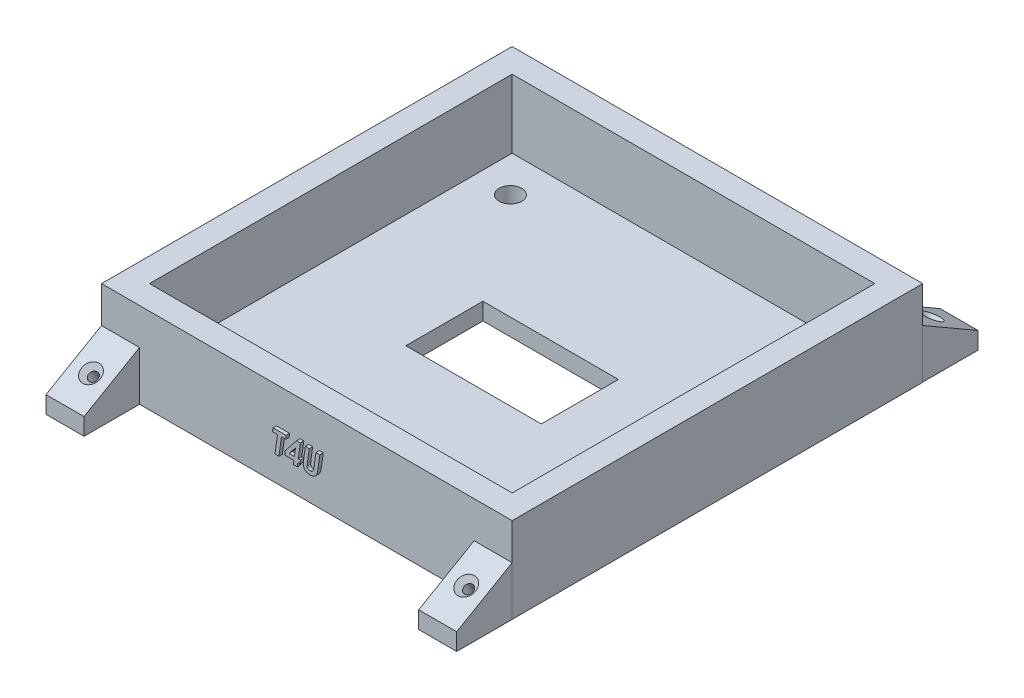
from build123d import *

# Parameters (mm, degrees)
SKETCH1_W                                            = 106
SKETCH1_H                                            = 106
SKETCH1_W_2                                          = 39.59401571
SKETCH1_H_2                                          = 22.527629628
BOSS_EXTRUDE1_DEPTH                                  = 5
SKETCH1_4_W                                          = 106
SKETCH1_4_H                                          = 106
BOSS_EXTRUDE2_DEPTH                                  = 25
SKETCH1_6_W                                          = 11.041643383
SKETCH1_6_H                                          = 16.216795515
BOSS_EXTRUDE4_DEPTH                                  = 5
SKETCH1_8_W                                          = 11.041643383
SKETCH1_8_H                                          = 16.216795515
BOSS_EXTRUDE5_DEPTH                                  = 5
SKETCH1_10_W                                         = 11.121003358
SKETCH1_10_H                                         = 16.216795515
SKETCH1_10_W_2                                       = 11.11598595
BOSS_EXTRUDE7_DEPTH                                  = 5
DRAFT1_ANGLE                                         = 1
DRAFT2_ANGLE                                         = 45
DRAFT3_ANGLE                                         = 30
DRAFT4_ANGLE                                         = 30
DRAFT6_ANGLE                                         = 30
DRAFT7_ANGLE                                         = 30
CSK_FOR_M2_5_OVAL_HEAD_MACHINE_SCREW1_D              = 2.7
CSK_FOR_M2_5_OVAL_HEAD_MACHINE_SCREW1_CSINK_D        = 5.5
CSK_FOR_M2_5_OVAL_HEAD_MACHINE_SCREW1_CSINK_ANGLE    = 90
CSK_FOR_M2_5_OVAL_HEAD_MACHINE_SCREW1_ON_D           = 2.7
CSK_FOR_M2_5_OVAL_HEAD_MACHINE_SCREW1_ON_CSINK_D     = 5.5
CSK_FOR_M2_5_OVAL_HEAD_MACHINE_SCREW1_ON_CSINK_ANGLE = 90
CSK_FOR_M2_5_OVAL_HEAD_MACHINE_SCREW_2_D             = 2.7
CSK_FOR_M2_5_OVAL_HEAD_MACHINE_SCREW_2_CSINK_D       = 5.5
CSK_FOR_M2_5_OVAL_HEAD_MACHINE_SCREW_2_CSINK_ANGLE   = 90
BOSS_EXTRUDE9_DEPTH                                  = 1
SKETCH14_R                                           = 3.296320564
CUT_EXTRUDE1_DEPTH                                   = 10


with BuildPart() as part:
    # Sketch1 → Boss-Extrude1 (new body)
    with BuildSketch(Plane(origin=(0, 0, 0), x_dir=(1, 0, 0), z_dir=(0, 1, 0))):
        with Locations((5.031290625, 4.83488638)):
            Rectangle(SKETCH1_W, SKETCH1_H)
        with Locations((5.031290625, 4.83488638)):
            Rectangle(SKETCH1_W_2, SKETCH1_H_2, mode=Mode.SUBTRACT)
    extrude(amount=BOSS_EXTRUDE1_DEPTH)

    # Sketch1<4> → Boss-Extrude2 (add)
    with BuildSketch(Plane(origin=(0, 0, 0), x_dir=(1, 0, 0), z_dir=(0, 1, 0))):
        Polygon((-54.910689044, 64.83488638), (-54.968709375, 64.83488638), (-54.968709375, -55.16511362), (-43.869045661, -55.16511362), (53.931626911, -55.16511362), (65.031290625, -55.16511362), (65.031290625, 64.83488638), (64.973270294, 64.83488638), (53.931626911, 64.83488638), (-43.869045661, 64.83488638), align=None)
        with Locations((5.031290625, 4.83488638)):
            Rectangle(SKETCH1_4_W, SKETCH1_4_H, mode=Mode.SUBTRACT)
    extrude(amount=BOSS_EXTRUDE2_DEPTH)

    # Sketch1<6> → Boss-Extrude4 (add)
    with BuildSketch(Plane(origin=(0, 0, 0), x_dir=(1, 0, 0), z_dir=(0, 1, 0))):
        with Locations((-49.389867353, 72.943284138)):
            Rectangle(SKETCH1_6_W, SKETCH1_6_H)
    extrude(amount=BOSS_EXTRUDE4_DEPTH)

    # Sketch1<8> → Boss-Extrude5 (add)
    with BuildSketch(Plane(origin=(0, 0, 0), x_dir=(1, 0, 0), z_dir=(0, 1, 0))):
        with Locations((59.452448602, 72.943284138)):
            Rectangle(SKETCH1_8_W, SKETCH1_8_H)
    extrude(amount=BOSS_EXTRUDE5_DEPTH)

    # Sketch1<10> → Boss-Extrude7 (add)
    with BuildSketch(Plane(origin=(0, 0, 0), x_dir=(1, 0, 0), z_dir=(0, 1, 0))):
        with Locations((-49.42954734, -63.273511378)):
            Rectangle(SKETCH1_10_W, SKETCH1_10_H)
        with Locations((59.489619886, -63.273511378)):
            Rectangle(SKETCH1_10_W_2, SKETCH1_10_H)
    extrude(amount=BOSS_EXTRUDE7_DEPTH)

    # Draft1
    draft1_faces = [part.faces().sort_by_distance(p)[0] for p in [
        (59.489619886, 5, 63.273511377),
    ]]
    draft(draft1_faces, Plane(origin=(0, 5, 71.381909135), x_dir=(1, 0, 0), z_dir=(0, 0, 1)), DRAFT1_ANGLE)

    # Draft2
    draft2_faces = [part.faces().sort_by_distance(p)[0] for p in [
        (59.489619886, 5.141532609, 63.273511377),
    ]]
    draft(draft2_faces, Plane(origin=(0, 5, 71.381909135), x_dir=(1, 0, 0), z_dir=(0, 0, 1)), DRAFT2_ANGLE)

    # Draft3
    draft3_faces = [part.faces().sort_by_distance(p)[0] for p in [
        (59.489619886, 13.108397758, 63.273511377),
    ]]
    draft(draft3_faces, Plane(origin=(0, 5, 71.381909135), x_dir=(1, 0, 0), z_dir=(0, 0, 1)), DRAFT3_ANGLE)

    # Draft4
    draft4_faces = [part.faces().sort_by_distance(p)[0] for p in [
        (-49.42954734, 5, 63.273511377),
    ]]
    draft(draft4_faces, Plane(origin=(0, 5, 71.381909135), x_dir=(1, 0, 0), z_dir=(0, 0, 1)), DRAFT4_ANGLE)

    # Draft6
    draft6_faces = [part.faces().sort_by_distance(p)[0] for p in [
        (-49.389867352, 5, -72.943284138),
    ]]
    draft(draft6_faces, Plane(origin=(0, 5, -81.051681895), x_dir=(-1, 0, 0), z_dir=(0, 0, -1)), DRAFT6_ANGLE)

    # Draft7
    draft7_faces = [part.faces().sort_by_distance(p)[0] for p in [
        (59.452448603, 5, -72.943284138),
    ]]
    draft(draft7_faces, Plane(origin=(0, 5, -81.051681895), x_dir=(-1, 0, 0), z_dir=(0, 0, -1)), DRAFT7_ANGLE)

    # CSK for M2.5 Oval Head Machine Screw1 (through all)
    with Locations(Plane(origin=(59.56504546, 9.768238454, 63.123077871), x_dir=(0, -0.5, 0.866025403784), z_dir=(0, 0.866025403784, 0.5))):
        with Locations((0, 0)):
            CounterSinkHole(CSK_FOR_M2_5_OVAL_HEAD_MACHINE_SCREW1_D / 2, CSK_FOR_M2_5_OVAL_HEAD_MACHINE_SCREW1_CSINK_D / 2, counter_sink_angle=CSK_FOR_M2_5_OVAL_HEAD_MACHINE_SCREW1_CSINK_ANGLE)

    # CSK for M2.5 Oval Head Machine Screw1 on (through all)
    with Locations(Plane(origin=(-49.429743133, 9.378105131, 63.798808608), x_dir=(0, -0.500000174844, 0.866025302838), z_dir=(0, 0.866025302838, 0.500000174844))):
        with Locations((0, 0)):
            CounterSinkHole(CSK_FOR_M2_5_OVAL_HEAD_MACHINE_SCREW1_ON_D / 2, CSK_FOR_M2_5_OVAL_HEAD_MACHINE_SCREW1_ON_CSINK_D / 2, counter_sink_angle=CSK_FOR_M2_5_OVAL_HEAD_MACHINE_SCREW1_ON_CSINK_ANGLE)

    # CSK for M2.5 Oval Head Machine Screw 2 (through all)
    with Locations(Plane(origin=(58.993450062, 9.334850022, -73.543501414), x_dir=(0, 0.500000174844, 0.866025302838), z_dir=(0, 0.866025302838, -0.500000174844))):
        with Locations((-1e-09, 0), (0.598054978, -108.445190593)):
            CounterSinkHole(CSK_FOR_M2_5_OVAL_HEAD_MACHINE_SCREW_2_D / 2, CSK_FOR_M2_5_OVAL_HEAD_MACHINE_SCREW_2_CSINK_D / 2, counter_sink_angle=CSK_FOR_M2_5_OVAL_HEAD_MACHINE_SCREW_2_CSINK_ANGLE)

    # Sketch12 → Boss-Extrude9 (add)
    # profile 1 of 3: a face of its own
    with BuildSketch(Plane.XY.offset(55.16511362)):
        Polygon((-3.851170658, 14.560171439), (-0.024888607, 14.560171439), (-0.162268415, 13.501838106), (-1.398686684, 13.501838106), (-2.132651027, 8.210171439), (-3.281298864, 8.210171439), (-2.548606556, 13.501838106), (-3.997454713, 13.501838106), align=None)
    # profile 2 of 3: a face of its own
    with BuildSketch(Plane.XY.offset(55.16511362)):
        Polygon((3.033084149, 14.722991952), (4.138482787, 14.722991952), (3.543170287, 10.408248363), (4.165195527, 10.408248363), (4.02781572, 9.349915029), (3.398158268, 9.349915029), (3.240425896, 8.210171439), (2.09177806, 8.210171439), (2.249510431, 9.349915029), (-0.431939889, 9.349915029), (-0.350529633, 10.451497561), align=None)
        Polygon((2.722707547, 12.786954292), (0.838823332, 10.408248363), (2.394522451, 10.408248363), align=None, mode=Mode.SUBTRACT)
    # profile 3 of 3: a face of its own
    with BuildSketch(Plane.XY.offset(55.16511362)):
        with BuildLine():
            Line((5.587330944, 14.560171439), (6.737250816, 14.560171439))
            Line((6.737250816, 14.560171439), (6.18900362, 10.632126568))
            add(Edge.make_bspline(
                [(6.18900362, 10.632126568), (6.183402023, 10.589736798), (6.172653558, 10.508398408), (6.158581474, 10.390948009), (6.147050147, 10.283246207), (6.13835648, 10.185232364), (6.130880723, 10.097032869), (6.123537243, 10.018693331), (6.12156611, 9.949475892), (6.120711369, 9.906641739), (6.120313717, 9.886713907)],
                knots=[0, 0, 0, 0, 1.370131483, 2.629037392, 3.790386942, 4.840899086, 5.781938864, 6.627066857, 7.36126714, 8, 8, 8, 8], degree=3))
            add(Edge.make_bspline(
                [(6.120313717, 9.886713907), (6.122742642, 9.828360814), (6.127388042, 9.71675862), (6.16976809, 9.558832982), (6.242605071, 9.422303405), (6.342570448, 9.306046085), (6.471150802, 9.214343156), (6.626800051, 9.151679105), (6.806028148, 9.111359223), (6.934173097, 9.107645252), (7.001834149, 9.10568426)],
                knots=[0, 0, 0, 0, 1.044998619, 1.998593913, 2.903381636, 3.798178852, 4.724466667, 5.705876195, 6.788693348, 8, 8, 8, 8], degree=3))
            add(Edge.make_bspline(
                [(7.001834149, 9.10568426), (7.057956567, 9.10757675), (7.167183867, 9.111259975), (7.325257031, 9.141736219), (7.473400904, 9.188647388), (7.56300684, 9.236972554), (7.607322931, 9.260872561)],
                knots=[0, 0, 0, 0, 1.064320597, 2.071415827, 3.046186936, 4, 4, 4, 4], degree=3))
            add(Edge.make_bspline(
                [(7.607322931, 9.260872561), (7.638661016, 9.282340052), (7.702720081, 9.326222359), (7.786339544, 9.413823207), (7.858235271, 9.520602949), (7.910381874, 9.624167973), (7.948256851, 9.722135286), (7.977464559, 9.813799465), (8.004312179, 9.922521662), (8.034401264, 10.046840649), (8.061248289, 10.18798869), (8.090077245, 10.345103027), (8.115677693, 10.519286472), (8.133525812, 10.641031997), (8.142849774, 10.704632577)],
                knots=[0, 0, 0, 0, 0.859785812, 1.75751252, 2.725816041, 3.770921983, 4.379908327, 5.106796295, 5.951169398, 6.919234109, 8.007475297, 9.209126838, 10.542031388, 12, 12, 12, 12], degree=3))
            Line((8.142849774, 10.704632577), (8.680920688, 14.560171439))
            Line((8.680920688, 14.560171439), (9.83084056, 14.560171439))
            Line((9.83084056, 14.560171439), (9.300401858, 10.761874164))
            add(Edge.make_bspline(
                [(9.300401858, 10.761874164), (9.287330457, 10.668092192), (9.262027799, 10.486555944), (9.217376218, 10.225362872), (9.170597614, 9.984815521), (9.121368674, 9.764847607), (9.067892151, 9.565539541), (9.013042193, 9.38586844), (8.953041543, 9.227611129), (8.890292597, 9.087508153), (8.821373712, 8.962161975), (8.747602604, 8.845752783), (8.666530187, 8.737141123), (8.575826106, 8.63806749), (8.481605009, 8.543048189), (8.377649998, 8.458270008), (8.267945247, 8.379873555), (8.150621707, 8.310376789), (8.026985628, 8.247221014), (7.895497152, 8.194520818), (7.758455425, 8.148438624), (7.614268415, 8.111548668), (7.463936721, 8.082329695), (7.306681889, 8.062566996), (7.143267757, 8.04903768), (7.031968043, 8.047921181), (6.975121409, 8.047350927)],
                knots=[0, 0, 0, 0, 1.689301192, 3.270025079, 4.726951413, 6.061161684, 7.290631986, 8.408026906, 9.411210366, 10.308389253, 11.14458747, 11.960942218, 12.765860093, 13.558707188, 14.355765744, 15.150991277, 15.948624031, 16.759492273, 17.581610214, 18.423095804, 19.284310986, 20.159533266, 21.076429259, 22.014764283, 22.986035413, 24, 24, 24, 24], degree=3))
            add(Edge.make_bspline(
                [(6.975121409, 8.047350927), (6.899147588, 8.048587808), (6.751454442, 8.050992305), (6.536301922, 8.076231064), (6.333976611, 8.114679105), (6.144184028, 8.169981914), (5.966590773, 8.239025973), (5.802820172, 8.326551549), (5.651359669, 8.428658918), (5.513849709, 8.546937553), (5.392382824, 8.679882671), (5.283545327, 8.822523738), (5.194999105, 8.979481857), (5.120877418, 9.146334823), (5.063065349, 9.324939947), (5.023512275, 9.515179828), (4.996651616, 9.716770462), (4.994428674, 9.855245029), (4.993290479, 9.926147)],
                knots=[0, 0, 0, 0, 1.177265359, 2.288604451, 3.35342386, 4.366487498, 5.349088925, 6.301818939, 7.238910628, 8.175748691, 9.10608431, 10.02633368, 10.950892497, 11.892606604, 12.852970325, 13.854711106, 14.901565705, 16, 16, 16, 16], degree=3))
            add(Edge.make_bspline(
                [(4.993290479, 9.926147), (4.993463542, 9.959650681), (4.993829568, 10.030510458), (4.999712409, 10.142016979), (5.007029362, 10.26504099), (5.018557194, 10.399061752), (5.03427852, 10.544419142), (5.052121268, 10.700877502), (5.072117704, 10.868893718), (5.088076227, 10.984505296), (5.096325335, 11.044265991)],
                knots=[0, 0, 0, 0, 0.71553134, 1.513337966, 2.384471215, 3.347928436, 4.386088841, 5.507247356, 6.711473103, 8, 8, 8, 8], degree=3))
            Line((5.096325335, 11.044265991), (5.587330944, 14.560171439))
        make_face()
    extrude(amount=BOSS_EXTRUDE9_DEPTH)

    # Sketch14 → Cut-Extrude1 (cut)
    with BuildSketch(Plane(origin=(0, 0, 0), x_dir=(-1, 0, 0), z_dir=(0, -1, 0))):
        with Locations(Location((37.694214755, -37.98017666, 0), (0, 0, 90))):
            Circle(SKETCH14_R)
        with Locations(Location((-47.311196673, -37.942022361, 0), (0, 0, 90))):
            Circle(SKETCH14_R)
        with Locations(Location((-47.311196673, 47.057977639, 0), (0, 0, 90))):
            Circle(SKETCH14_R)
        with Locations(Location((37.688803327, 47.057977639, 0), (0, 0, 90))):
            Circle(SKETCH14_R)
    extrude(amount=-CUT_EXTRUDE1_DEPTH, mode=Mode.SUBTRACT)


solid = part.part
